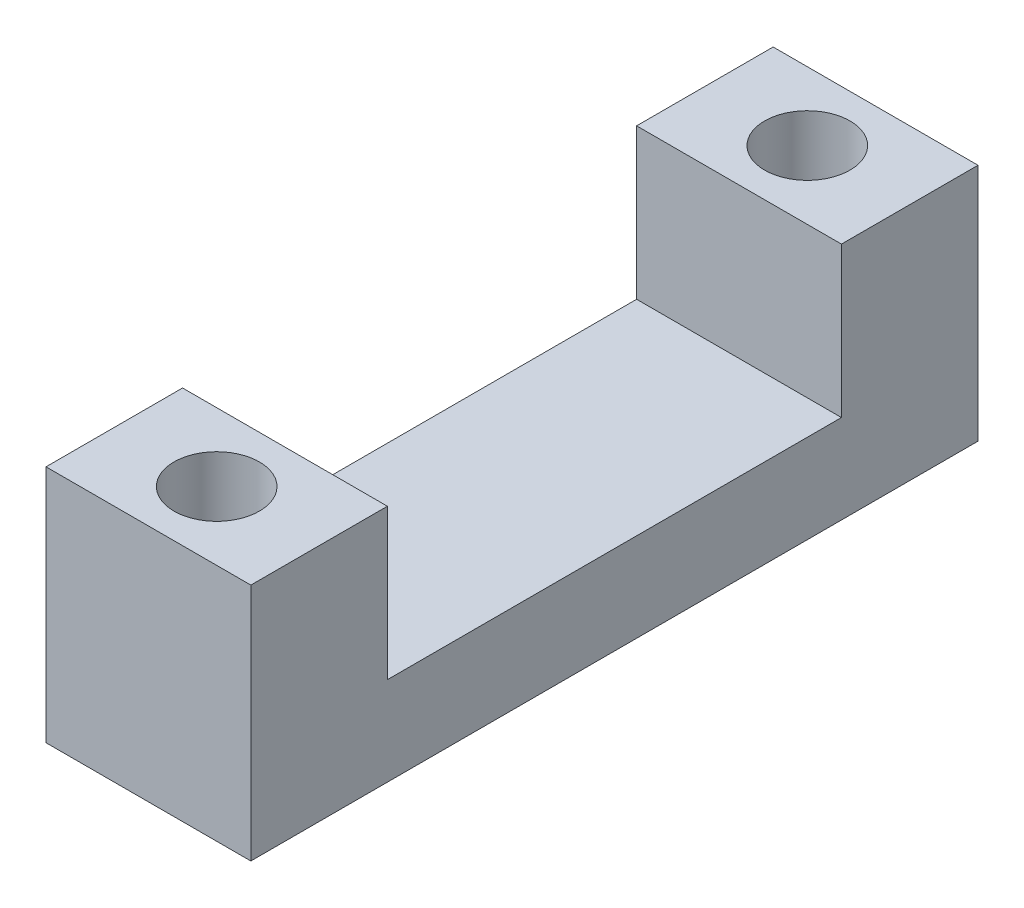
from build123d import *

# Parameters (mm, degrees)
EXTRUDE_1_DEPTH    = 6
HOLE_WIZARD_M3_1_D = 2.5


with BuildPart() as part:
    # 草图1 → 凸台-拉伸1 (new body)
    with BuildSketch(Plane(origin=(0, 0, 0), x_dir=(0, 0, -1), z_dir=(1, 0, 0))):
        Polygon((0, 0), (0, 7), (4, 7), (4, 2.6), (17.3, 2.6), (17.3, 7), (21.3, 7), (21.3, 0), align=None)
    extrude(amount=EXTRUDE_1_DEPTH)

    # M3 螺纹孔1 (through all)
    with Locations(Plane(origin=(3, 7, -2), x_dir=(0, 0, 1), z_dir=(0, 1, 0))):
        with Locations((0, 0), (-17.3, 0)):
            Hole(HOLE_WIZARD_M3_1_D / 2)


solid = part.part
